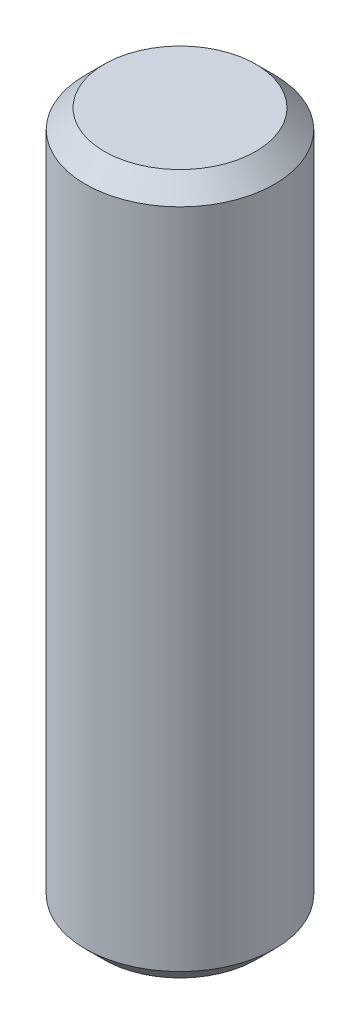
from build123d import *

# Parameters (mm, degrees)
SKETCH2_W     = 10
SKETCH2_H     = 74
CHAMFER1_SIZE = 2


with BuildPart() as part:
    # Sketch2 → Revolve1 (revolve)
    with BuildSketch(Plane.XY, mode=Mode.PRIVATE) as revolve1_sk:
        with Locations((5, 37)):
            Rectangle(SKETCH2_W, SKETCH2_H)
    revolve(revolve1_sk.sketch.rotate(Axis((0, 0, 0), (0, 1, 0)), 90), axis=Axis((0, 0, 0), (0, 1, 0)))

    # Chamfer1
    chamfer1_edges = [part.edges().sort_by_distance(p)[0] for p in [
        (0, 0, 10),
        (0, 74, 10),
    ]]
    chamfer(chamfer1_edges, length=CHAMFER1_SIZE)


solid = part.part
